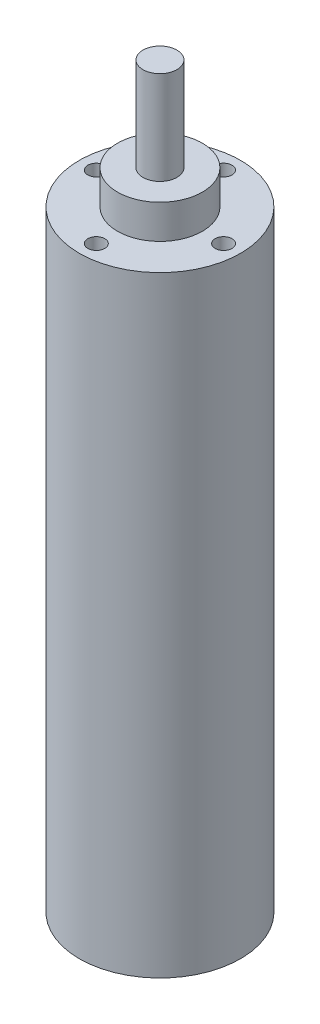
from build123d import *

# Parameters (mm, degrees)
SKETCH_1_R          = 9.5
EXTRUDE_1_DEPTH     = 72
SKETCH_2_R          = 5
EXTRUDE_2_DEPTH     = 4
SKETCH_3_R          = 2
EXTRUDE_3_DEPTH     = 11
SKETCH_4_R          = 1
CUT_EXTRUDE_1_DEPTH = 3


with BuildPart() as part:
    # 草图1 → 凸台-拉伸1 (new body)
    with BuildSketch(Plane(origin=(0, 0, 0), x_dir=(1, 0, 0), z_dir=(0, 1, 0))):
        with Locations(Location((0, 0, 0), (0, 0, 270))):
            Circle(SKETCH_1_R)
    extrude(amount=EXTRUDE_1_DEPTH)

    # 草图2 → 凸台-拉伸2 (add)
    with BuildSketch(Plane(origin=(0, 72, 0), x_dir=(1, 0, 0), z_dir=(0, 1, 0))):
        with Locations(Location((0, 0, 0), (0, 0, 270))):
            Circle(SKETCH_2_R)
    extrude(amount=EXTRUDE_2_DEPTH)

    # 草图3 → 凸台-拉伸3 (add)
    with BuildSketch(Plane(origin=(0, 76, 0), x_dir=(1, 0, 0), z_dir=(0, 1, 0))):
        with Locations(Location((0, 0, 0), (0, 0, 270))):
            Circle(SKETCH_3_R)
    extrude(amount=EXTRUDE_3_DEPTH)

    # 草图4 → 切除-拉伸1 (cut)
    with BuildSketch(Plane(origin=(0, 72, 0), x_dir=(1, 0, 0), z_dir=(0, 1, 0))):
        with Locations(Location((7.5, 0, 0), (0, 0, 270))):
            Circle(SKETCH_4_R)
        with Locations(Location((0, 7.5, 0), (0, 0, 270))):
            Circle(SKETCH_4_R)
        with Locations(Location((0, -7.5, 0), (0, 0, 270))):
            Circle(SKETCH_4_R)
        with Locations(Location((-7.5, 0, 0), (0, 0, 270))):
            Circle(SKETCH_4_R)
    extrude(amount=-CUT_EXTRUDE_1_DEPTH, mode=Mode.SUBTRACT)


solid = part.part
